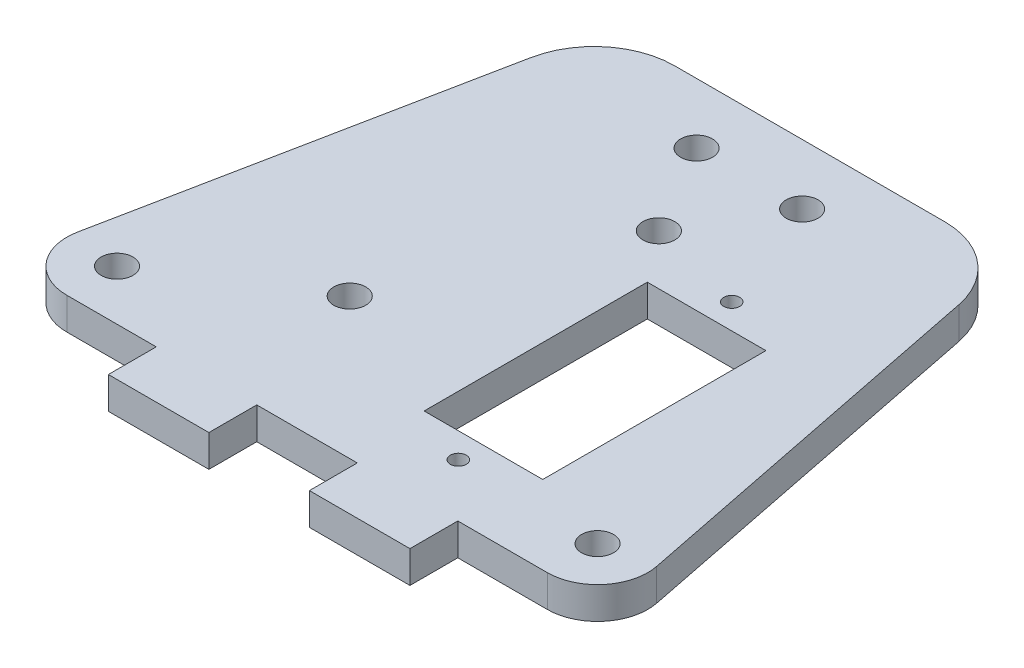
from build123d import *

# Parameters (mm, degrees)
CROQUIS1_R              = 0.79375
CROQUIS1_R_2            = 1.5875
CROQUIS1_W              = 11.8
CROQUIS1_H              = 22.2
SALIENTE_EXTRUIR1_DEPTH = 3.175
CROQUIS2_R              = 1.5875
CORTAR_EXTRUIR1_DEPTH   = 3.175
CROQUIS3_W              = 10
CROQUIS3_H              = 4.7625
SALIENTE_EXTRUIR2_DEPTH = 3.175


with BuildPart() as part:
    # Croquis1 → Saliente-Extruir1 (new body)
    with BuildSketch(Plane(origin=(0, 0, 0), x_dir=(1, 0, 0), z_dir=(0, 1, 0))):
        with BuildLine():
            Line((8.713785816, 43.568929081), (0, 0))
            Line((0, 0), (60, 0))
            Line((60, 0), (51.286214184, 43.568929081))
            ThreePointArc((51.286214184, 43.568929081), (48.513480023, 48.186737131), (43.441568778, 50))
            Line((43.441568778, 50), (16.558431222, 50))
            ThreePointArc((16.558431222, 50), (11.486519977, 48.186737131), (8.713785816, 43.568929081))
        make_face()
        with Locations(Location((39.75, 5.3, 0), (0, 0, 270))):
            Circle(CROQUIS1_R, mode=Mode.SUBTRACT)
        with Locations(Location((39.75, 32.5, 0), (0, 0, 270))):
            Circle(CROQUIS1_R, mode=Mode.SUBTRACT)
        with Locations(Location((20.25, 14, 0), (0, 0, 270))):
            Circle(CROQUIS1_R_2, mode=Mode.SUBTRACT)
        with Locations(Location((24.75, 44, 0), (0, 0, 270))):
            Circle(CROQUIS1_R_2, mode=Mode.SUBTRACT)
        with Locations(Location((35.25, 44, 0), (0, 0, 270))):
            Circle(CROQUIS1_R_2, mode=Mode.SUBTRACT)
        with Locations((39.75, 18.9)):
            Rectangle(CROQUIS1_W, CROQUIS1_H, mode=Mode.SUBTRACT)
    extrude(amount=SALIENTE_EXTRUIR1_DEPTH)

    # Croquis2 → Cortar-Extruir1 (cut)
    with BuildSketch(Plane(origin=(0, 3.175, 0), x_dir=(1, 0, 0), z_dir=(0, 1, 0))):
        with Locations(Location((30, 35, 0), (0, 0, 270))):
            Circle(CROQUIS2_R)
        with Locations(Location((6.099019514, 5, 0), (0, 0, 270))):
            Circle(CROQUIS2_R)
        with Locations(Location((53.900980486, 5, 0), (0, 0, 270))):
            Circle(CROQUIS2_R)
        with BuildLine():
            Line((53.900980486, 0), (60, 0))
            Line((60, 0), (58.803883865, 5.980580676))
            ThreePointArc((58.803883865, 5.980580676), (57.767691193, 1.830055472), (53.900980486, 0))
        make_face()
        with BuildLine():
            Line((1.196116135, 5.980580676), (0, 0))
            Line((0, 0), (6.099019514, 0))
            ThreePointArc((6.099019514, 0), (2.232308807, 1.830055472), (1.196116135, 5.980580676))
        make_face()
    extrude(amount=-CORTAR_EXTRUIR1_DEPTH, mode=Mode.SUBTRACT)

    # Croquis3 → Saliente-Extruir2 (add)
    with BuildSketch(Plane(origin=(0, 3.175, 0), x_dir=(1, 0, 0), z_dir=(0, 1, 0))):
        with Locations((20, -2.38125)):
            Rectangle(CROQUIS3_W, CROQUIS3_H)
        with Locations((40, -2.38125)):
            Rectangle(CROQUIS3_W, CROQUIS3_H)
    extrude(amount=-SALIENTE_EXTRUIR2_DEPTH)


solid = part.part
